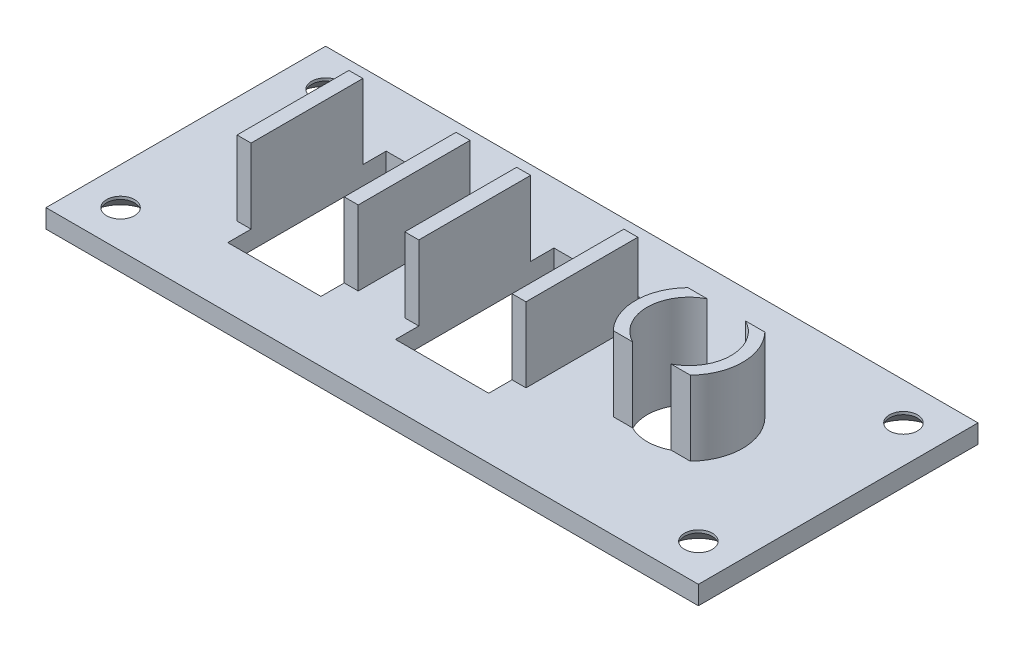
from build123d import *

# Parameters (mm, degrees)
SKETCH1_W           = 70
SKETCH1_H           = 30
SKETCH1_R           = 4.5
SKETCH1_W_2         = 10
SKETCH1_H_2         = 17
BOSS_EXTRUDE1_DEPTH = 2
SKETCH2_W           = 1.5
SKETCH2_H           = 12
BOSS_EXTRUDE2_DEPTH = 8
CUT_EXTRUDE1_REACH  = 40.91
SKETCH3_R           = 1.5
CHAMFER1_SIZE       = 1.7


with BuildPart() as part:
    # Sketch1 → Boss-Extrude1 (new body)
    with BuildSketch(Plane(origin=(0, 0, 0), x_dir=(1, 0, 0), z_dir=(0, 1, 0))):
        Rectangle(SKETCH1_W, SKETCH1_H)
        with Locations(Location((19, 0, 0), (0, 0, 270))):
            Circle(SKETCH1_R, mode=Mode.SUBTRACT)
        with Locations((-17, 0)):
            Rectangle(SKETCH1_W_2, SKETCH1_H_2, mode=Mode.SUBTRACT)
        with Locations((1, 0)):
            Rectangle(SKETCH1_W_2, SKETCH1_H_2, mode=Mode.SUBTRACT)
    extrude(amount=BOSS_EXTRUDE1_DEPTH)

    # Sketch2 → Boss-Extrude2 (add)
    with BuildSketch(Plane(origin=(0, 2, 0), x_dir=(1, 0, 0), z_dir=(0, 1, 0))):
        with Locations((-22.75, 0)):
            Rectangle(SKETCH2_W, SKETCH2_H)
        with Locations((-11.25, 0)):
            Rectangle(SKETCH2_W, SKETCH2_H)
        with Locations((-4.75, 0)):
            Rectangle(SKETCH2_W, SKETCH2_H)
        with Locations((6.75, 0)):
            Rectangle(SKETCH2_W, SKETCH2_H)
        with BuildLine():
            Line((16.938447187, 4), (14.86932209, 4))
            ThreePointArc((14.86932209, 4), (13.25, 0), (14.86932209, -4))
            Line((14.86932209, -4), (16.938447187, -4))
            ThreePointArc((16.938447187, -4), (14.5, 0), (16.938447187, 4))
        make_face()
        with BuildLine():
            Line((23.13067791, 4), (21.061552813, 4))
            ThreePointArc((21.061552813, 4), (22.842329219, 2.342329219), (23.5, 0))
            ThreePointArc((23.5, 0), (22.842329219, -2.342329219), (21.061552813, -4))
            Line((21.061552813, -4), (23.13067791, -4))
            ThreePointArc((23.13067791, -4), (24.75, 0), (23.13067791, 4))
        make_face()
    extrude(amount=BOSS_EXTRUDE2_DEPTH)

    # Sketch3 → Cut-Extrude1 (cut, up to next)
    with BuildSketch(Plane(origin=(0, 2, 0), x_dir=(1, 0, 0), z_dir=(0, 1, 0)), mode=Mode.PRIVATE) as cut_extrude1_sk1:
        with Locations(Location((-31, 11, 0), (0, 0, 270))):
            Circle(SKETCH3_R)
    cut_extrude1_tool1 = extrude(cut_extrude1_sk1.sketch, amount=-CUT_EXTRUDE1_REACH, mode=Mode.PRIVATE) & part.part
    # Sketch3 → Cut-Extrude1 (cut, up to next)
    with BuildSketch(Plane(origin=(0, 2, 0), x_dir=(1, 0, 0), z_dir=(0, 1, 0)), mode=Mode.PRIVATE) as cut_extrude1_sk2:
        with Locations(Location((31, 11, 0), (0, 0, 90))):
            Circle(SKETCH3_R)
    cut_extrude1_tool2 = extrude(cut_extrude1_sk2.sketch, amount=-CUT_EXTRUDE1_REACH, mode=Mode.PRIVATE) & part.part
    # Sketch3 → Cut-Extrude1 (cut, up to next)
    with BuildSketch(Plane(origin=(0, 2, 0), x_dir=(1, 0, 0), z_dir=(0, 1, 0)), mode=Mode.PRIVATE) as cut_extrude1_sk3:
        with Locations(Location((31, -11, 0), (0, 0, 270))):
            Circle(SKETCH3_R)
    cut_extrude1_tool3 = extrude(cut_extrude1_sk3.sketch, amount=-CUT_EXTRUDE1_REACH, mode=Mode.PRIVATE) & part.part
    # Sketch3 → Cut-Extrude1 (cut, up to next)
    with BuildSketch(Plane(origin=(0, 2, 0), x_dir=(1, 0, 0), z_dir=(0, 1, 0)), mode=Mode.PRIVATE) as cut_extrude1_sk4:
        with Locations(Location((-31, -11, 0), (0, 0, 90))):
            Circle(SKETCH3_R)
    cut_extrude1_tool4 = extrude(cut_extrude1_sk4.sketch, amount=-CUT_EXTRUDE1_REACH, mode=Mode.PRIVATE) & part.part
    add(cut_extrude1_tool1.solids().sort_by_distance((-31, 2, -11))[0], mode=Mode.SUBTRACT)
    add(cut_extrude1_tool2.solids().sort_by_distance((31, 2, -11))[0], mode=Mode.SUBTRACT)
    add(cut_extrude1_tool3.solids().sort_by_distance((31, 2, 11))[0], mode=Mode.SUBTRACT)
    add(cut_extrude1_tool4.solids().sort_by_distance((-31, 2, 11))[0], mode=Mode.SUBTRACT)

    # Chamfer1
    chamfer1_edges = [part.edges().sort_by_distance(p)[0] for p in [
        (-31, 0, -12.5),
        (31, 0, -9.5),
        (31, 0, 9.5),
        (-31, 0, 12.5),
    ]]
    chamfer(chamfer1_edges, length=CHAMFER1_SIZE)


solid = part.part
